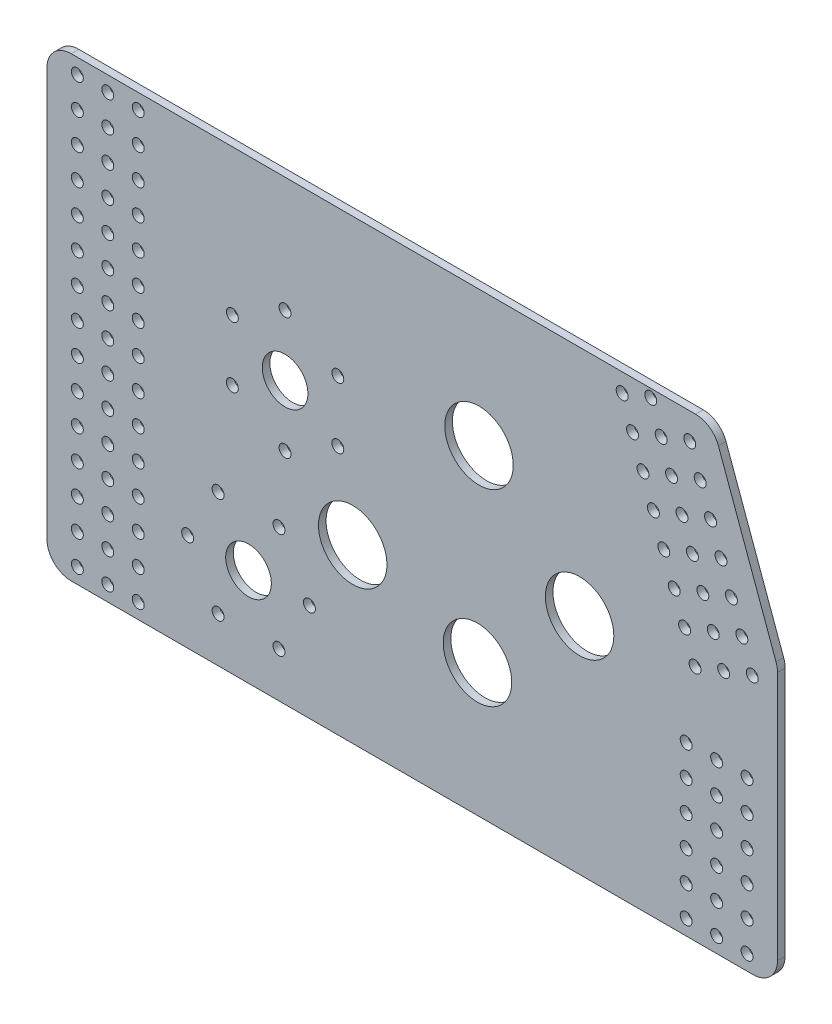
from build123d import *

# Parameters (mm, degrees)
SKETCH1_R           = 2.4892
SKETCH1_R_2         = 14.2875
SKETCH1_R_3         = 9.525
BOSS_EXTRUDE1_DEPTH = 3.175
BOSS_EXTRUDE2_START = -3.175
SKETCH2_R           = 2.4892
BOSS_EXTRUDE2_DEPTH = 3.175
FILLET1_R           = 10.16
CUT_EXTRUDE1_START  = -3.175
SKETCH3_R           = 9.525
SKETCH3_R_2         = 2.4892
CUT_EXTRUDE1_DEPTH  = 3.175
BOSS_EXTRUDE3_START = -3.175
SKETCH4_R           = 2.4892
BOSS_EXTRUDE3_DEPTH = 3.175
BOSS_EXTRUDE4_START = -3.175
SKETCH6_R           = 14.2875
SKETCH6_R_2         = 2.4892
SKETCH6_R_3         = 9.525
BOSS_EXTRUDE4_DEPTH = 3.175
SKETCH5_R           = 14.2875
CUT_EXTRUDE2_DEPTH  = 244.979693059
SKETCH7_R           = 2.4892
SKETCH7_R_2         = 9.525
CUT_EXTRUDE3_DEPTH  = 244.979693059


with BuildPart() as part:
    # Sketch1 → Boss-Extrude1 (new body)
    with BuildSketch(Plane.XY):
        Polygon((-152.4, 0), (152.4, 0), (152.4, 116.084254136), (125.314883545, 190.5), (-152.4, 190.5), align=None)
        with Locations((-139.7, 184.15)):
            Circle(SKETCH1_R, mode=Mode.SUBTRACT)
        with Locations((-127, 184.15)):
            Circle(SKETCH1_R, mode=Mode.SUBTRACT)
        with Locations((-114.3, 184.15)):
            Circle(SKETCH1_R, mode=Mode.SUBTRACT)
        with Locations((-127, 171.45)):
            Circle(SKETCH1_R, mode=Mode.SUBTRACT)
        with Locations((-114.3, 171.45)):
            Circle(SKETCH1_R, mode=Mode.SUBTRACT)
        with Locations((-127, 158.75)):
            Circle(SKETCH1_R, mode=Mode.SUBTRACT)
        with Locations((-114.3, 158.75)):
            Circle(SKETCH1_R, mode=Mode.SUBTRACT)
        with Locations((-127, 146.05)):
            Circle(SKETCH1_R, mode=Mode.SUBTRACT)
        with Locations((-114.3, 146.05)):
            Circle(SKETCH1_R, mode=Mode.SUBTRACT)
        with Locations((-127, 133.35)):
            Circle(SKETCH1_R, mode=Mode.SUBTRACT)
        with Locations((-114.3, 133.35)):
            Circle(SKETCH1_R, mode=Mode.SUBTRACT)
        with Locations((-127, 120.65)):
            Circle(SKETCH1_R, mode=Mode.SUBTRACT)
        with Locations((-114.3, 120.65)):
            Circle(SKETCH1_R, mode=Mode.SUBTRACT)
        with Locations((-127, 107.95)):
            Circle(SKETCH1_R, mode=Mode.SUBTRACT)
        with Locations((-114.3, 107.95)):
            Circle(SKETCH1_R, mode=Mode.SUBTRACT)
        with Locations((-127, 95.25)):
            Circle(SKETCH1_R, mode=Mode.SUBTRACT)
        with Locations((-114.3, 95.25)):
            Circle(SKETCH1_R, mode=Mode.SUBTRACT)
        with Locations((-127, 82.55)):
            Circle(SKETCH1_R, mode=Mode.SUBTRACT)
        with Locations((-114.3, 82.55)):
            Circle(SKETCH1_R, mode=Mode.SUBTRACT)
        with Locations((-127, 69.85)):
            Circle(SKETCH1_R, mode=Mode.SUBTRACT)
        with Locations((-114.3, 69.85)):
            Circle(SKETCH1_R, mode=Mode.SUBTRACT)
        with Locations((-127, 57.15)):
            Circle(SKETCH1_R, mode=Mode.SUBTRACT)
        with Locations((-114.3, 57.15)):
            Circle(SKETCH1_R, mode=Mode.SUBTRACT)
        with Locations((-127, 44.45)):
            Circle(SKETCH1_R, mode=Mode.SUBTRACT)
        with Locations((-114.3, 44.45)):
            Circle(SKETCH1_R, mode=Mode.SUBTRACT)
        with Locations((-127, 31.75)):
            Circle(SKETCH1_R, mode=Mode.SUBTRACT)
        with Locations((-114.3, 31.75)):
            Circle(SKETCH1_R, mode=Mode.SUBTRACT)
        with Locations((-127, 19.05)):
            Circle(SKETCH1_R, mode=Mode.SUBTRACT)
        with Locations((-114.3, 19.05)):
            Circle(SKETCH1_R, mode=Mode.SUBTRACT)
        with Locations((-127, 6.35)):
            Circle(SKETCH1_R, mode=Mode.SUBTRACT)
        with Locations((-114.3, 6.35)):
            Circle(SKETCH1_R, mode=Mode.SUBTRACT)
        with Locations((-139.7, 171.45)):
            Circle(SKETCH1_R, mode=Mode.SUBTRACT)
        with Locations((-139.7, 158.75)):
            Circle(SKETCH1_R, mode=Mode.SUBTRACT)
        with Locations((-139.7, 146.05)):
            Circle(SKETCH1_R, mode=Mode.SUBTRACT)
        with Locations((-139.7, 133.35)):
            Circle(SKETCH1_R, mode=Mode.SUBTRACT)
        with Locations((-139.7, 120.65)):
            Circle(SKETCH1_R, mode=Mode.SUBTRACT)
        with Locations((-139.7, 107.95)):
            Circle(SKETCH1_R, mode=Mode.SUBTRACT)
        with Locations((-139.7, 95.25)):
            Circle(SKETCH1_R, mode=Mode.SUBTRACT)
        with Locations((-139.7, 82.55)):
            Circle(SKETCH1_R, mode=Mode.SUBTRACT)
        with Locations((-139.7, 69.85)):
            Circle(SKETCH1_R, mode=Mode.SUBTRACT)
        with Locations((-139.7, 57.15)):
            Circle(SKETCH1_R, mode=Mode.SUBTRACT)
        with Locations((-139.7, 44.45)):
            Circle(SKETCH1_R, mode=Mode.SUBTRACT)
        with Locations((-139.7, 31.75)):
            Circle(SKETCH1_R, mode=Mode.SUBTRACT)
        with Locations((-139.7, 19.05)):
            Circle(SKETCH1_R, mode=Mode.SUBTRACT)
        with Locations((-139.7, 6.35)):
            Circle(SKETCH1_R, mode=Mode.SUBTRACT)
        with Locations((87.590706137, 182.74937795)):
            Circle(SKETCH1_R, mode=Mode.SUBTRACT)
        with Locations((99.524802421, 187.09303377)):
            Circle(SKETCH1_R, mode=Mode.SUBTRACT)
        with Locations((115.802554525, 179.502593307)):
            Circle(SKETCH1_R, mode=Mode.SUBTRACT)
        with Locations((91.934361957, 170.815281666)):
            Circle(SKETCH1_R, mode=Mode.SUBTRACT)
        with Locations((103.868458241, 175.158937486)):
            Circle(SKETCH1_R, mode=Mode.SUBTRACT)
        with Locations((120.146210345, 167.568497023)):
            Circle(SKETCH1_R, mode=Mode.SUBTRACT)
        with Locations((96.278017777, 158.881185382)):
            Circle(SKETCH1_R, mode=Mode.SUBTRACT)
        with Locations((108.212114061, 163.224841202)):
            Circle(SKETCH1_R, mode=Mode.SUBTRACT)
        with Locations((124.489866165, 155.634400739)):
            Circle(SKETCH1_R, mode=Mode.SUBTRACT)
        with Locations((100.621673597, 146.947089098)):
            Circle(SKETCH1_R, mode=Mode.SUBTRACT)
        with Locations((112.555769881, 151.290744918)):
            Circle(SKETCH1_R, mode=Mode.SUBTRACT)
        with Locations((128.833521986, 143.700304455)):
            Circle(SKETCH1_R, mode=Mode.SUBTRACT)
        with Locations((104.965329418, 135.012992814)):
            Circle(SKETCH1_R, mode=Mode.SUBTRACT)
        with Locations((116.899425702, 139.356648634)):
            Circle(SKETCH1_R, mode=Mode.SUBTRACT)
        with Locations((133.177177806, 131.766208171)):
            Circle(SKETCH1_R, mode=Mode.SUBTRACT)
        with Locations((109.308985238, 123.07889653)):
            Circle(SKETCH1_R, mode=Mode.SUBTRACT)
        with Locations((121.243081522, 127.42255235)):
            Circle(SKETCH1_R, mode=Mode.SUBTRACT)
        with Locations((137.520833626, 119.832111887)):
            Circle(SKETCH1_R, mode=Mode.SUBTRACT)
        with Locations((113.652641058, 111.144800246)):
            Circle(SKETCH1_R, mode=Mode.SUBTRACT)
        with Locations((125.586737342, 115.488456066)):
            Circle(SKETCH1_R, mode=Mode.SUBTRACT)
        with Locations((141.864489446, 107.898015603)):
            Circle(SKETCH1_R, mode=Mode.SUBTRACT)
        with Locations((117.996296878, 99.210703962)):
            Circle(SKETCH1_R, mode=Mode.SUBTRACT)
        with Locations((129.930393162, 103.554359782)):
            Circle(SKETCH1_R, mode=Mode.SUBTRACT)
        with Locations((146.208145266, 95.963919319)):
            Circle(SKETCH1_R, mode=Mode.SUBTRACT)
        with Locations((114.3, 69.85)):
            Circle(SKETCH1_R, mode=Mode.SUBTRACT)
        with Locations((127, 69.85)):
            Circle(SKETCH1_R, mode=Mode.SUBTRACT)
        with Locations((139.7, 69.85)):
            Circle(SKETCH1_R, mode=Mode.SUBTRACT)
        with Locations((114.3, 57.15)):
            Circle(SKETCH1_R, mode=Mode.SUBTRACT)
        with Locations((127, 57.15)):
            Circle(SKETCH1_R, mode=Mode.SUBTRACT)
        with Locations((139.7, 57.15)):
            Circle(SKETCH1_R, mode=Mode.SUBTRACT)
        with Locations((114.3, 44.45)):
            Circle(SKETCH1_R, mode=Mode.SUBTRACT)
        with Locations((127, 44.45)):
            Circle(SKETCH1_R, mode=Mode.SUBTRACT)
        with Locations((139.7, 44.45)):
            Circle(SKETCH1_R, mode=Mode.SUBTRACT)
        with Locations((114.3, 31.75)):
            Circle(SKETCH1_R, mode=Mode.SUBTRACT)
        with Locations((127, 31.75)):
            Circle(SKETCH1_R, mode=Mode.SUBTRACT)
        with Locations((139.7, 31.75)):
            Circle(SKETCH1_R, mode=Mode.SUBTRACT)
        with Locations((114.3, 19.05)):
            Circle(SKETCH1_R, mode=Mode.SUBTRACT)
        with Locations((127, 19.05)):
            Circle(SKETCH1_R, mode=Mode.SUBTRACT)
        with Locations((139.7, 19.05)):
            Circle(SKETCH1_R, mode=Mode.SUBTRACT)
        with Locations((114.3, 6.35)):
            Circle(SKETCH1_R, mode=Mode.SUBTRACT)
        with Locations((127, 6.35)):
            Circle(SKETCH1_R, mode=Mode.SUBTRACT)
        with Locations((139.7, 6.35)):
            Circle(SKETCH1_R, mode=Mode.SUBTRACT)
        with Locations((11.850775283, 132.016841695)):
            Circle(SKETCH1_R_2, mode=Mode.SUBTRACT)
        with Locations((-24.819733341, 71.744857423)):
            Circle(SKETCH1_R_2, mode=Mode.SUBTRACT)
        with Locations((57.635078008, 95.712451111)):
            Circle(SKETCH1_R_2, mode=Mode.SUBTRACT)
        with Locations((23.754601626, 49.678686248)):
            Circle(SKETCH1_R_2, mode=Mode.SUBTRACT)
        with Locations((-65.270180641, 36.953448556)):
            Circle(SKETCH1_R_3, mode=Mode.SUBTRACT)
        with Locations((-65.270180641, 106.549448556)):
            Circle(SKETCH1_R_3, mode=Mode.SUBTRACT)
        with Locations((-65.270180641, 131.949448556)):
            Circle(SKETCH1_R, mode=Mode.SUBTRACT)
        with Locations((-65.270180641, 11.553448556)):
            Circle(SKETCH1_R, mode=Mode.SUBTRACT)
        with Locations((-43.273135384, 119.249448556)):
            Circle(SKETCH1_R, mode=Mode.SUBTRACT)
        with Locations((-43.273135384, 93.849448556)):
            Circle(SKETCH1_R, mode=Mode.SUBTRACT)
        with Locations((-65.270180641, 81.149448556)):
            Circle(SKETCH1_R, mode=Mode.SUBTRACT)
        with Locations((-87.267225897, 93.849448556)):
            Circle(SKETCH1_R, mode=Mode.SUBTRACT)
        with Locations((-87.267225897, 119.249448556)):
            Circle(SKETCH1_R, mode=Mode.SUBTRACT)
        with Locations((-87.267225897, 24.253448556)):
            Circle(SKETCH1_R, mode=Mode.SUBTRACT)
        with Locations((-87.267225897, 49.653448556)):
            Circle(SKETCH1_R, mode=Mode.SUBTRACT)
        with Locations((-65.270180641, 62.353448556)):
            Circle(SKETCH1_R, mode=Mode.SUBTRACT)
        with Locations((-43.273135384, 49.653448556)):
            Circle(SKETCH1_R, mode=Mode.SUBTRACT)
        with Locations((-43.273135384, 24.253448556)):
            Circle(SKETCH1_R, mode=Mode.SUBTRACT)
    extrude(amount=BOSS_EXTRUDE1_DEPTH)

    # Sketch2 → Boss-Extrude2 (add)
    with BuildSketch(Plane.XY.offset(3.175).offset(BOSS_EXTRUDE2_START)):
        with Locations((146.208145266, 95.963919319)):
            Circle(SKETCH2_R)
    extrude(amount=BOSS_EXTRUDE2_DEPTH)

    # Fillet1
    fillet1_edges = [part.edges().sort_by_distance(p)[0] for p in [
        (-152.4, 190.5, 1.5875),
        (125.314883545, 190.5, 1.5875),
        (152.4, 116.084254136, 1.5875),
        (152.4, 0, 1.5875),
        (-152.4, 0, 1.5875),
    ]]
    fillet(fillet1_edges, radius=FILLET1_R)

    # Sketch3 → Cut-Extrude1 (cut)
    with BuildSketch(Plane.XY.offset(3.175).offset(CUT_EXTRUDE1_START)):
        with Locations((-65.270180641, 106.549448556)):
            Circle(SKETCH3_R)
        with Locations((-39.870180641, 106.549448556)):
            Circle(SKETCH3_R_2)
        with Locations((-52.570180641, 84.5524033)):
            Circle(SKETCH3_R_2)
        with Locations((-77.970180641, 84.5524033)):
            Circle(SKETCH3_R_2)
        with Locations((-90.670180641, 106.549448556)):
            Circle(SKETCH3_R_2)
        with Locations((-77.970180641, 128.546493812)):
            Circle(SKETCH3_R_2)
        with Locations((-52.570180641, 128.546493812)):
            Circle(SKETCH3_R_2)
        with Locations((-65.270180641, 36.953448556)):
            Circle(SKETCH3_R)
        with Locations((-39.870180641, 36.953448556)):
            Circle(SKETCH3_R_2)
        with Locations((-52.570180641, 14.9564033)):
            Circle(SKETCH3_R_2)
        with Locations((-77.970180641, 14.9564033)):
            Circle(SKETCH3_R_2)
        with Locations((-90.670180641, 36.953448556)):
            Circle(SKETCH3_R_2)
        with Locations((-77.970180641, 58.950493812)):
            Circle(SKETCH3_R_2)
        with Locations((-52.570180641, 58.950493812)):
            Circle(SKETCH3_R_2)
    extrude(amount=CUT_EXTRUDE1_DEPTH, mode=Mode.SUBTRACT)

    # Sketch4 → Boss-Extrude3 (add)
    with BuildSketch(Plane.XY.offset(3.175).offset(BOSS_EXTRUDE3_START)):
        with Locations((-65.270180641, 131.949448556)):
            Circle(SKETCH4_R)
        with Locations((-43.273135384, 119.249448556)):
            Circle(SKETCH4_R)
        with Locations((-43.273135384, 93.849448556)):
            Circle(SKETCH4_R)
        with Locations((-65.270180641, 81.149448556)):
            Circle(SKETCH4_R)
        with Locations((-87.267225897, 93.849448556)):
            Circle(SKETCH4_R)
        with Locations((-87.267225897, 119.249448556)):
            Circle(SKETCH4_R)
        with Locations((-65.270180641, 62.353448556)):
            Circle(SKETCH4_R)
        with Locations((-43.273135384, 49.653448556)):
            Circle(SKETCH4_R)
        with Locations((-43.273135384, 24.253448556)):
            Circle(SKETCH4_R)
        with Locations((-65.270180641, 11.553448556)):
            Circle(SKETCH4_R)
        with Locations((-87.267225897, 24.253448556)):
            Circle(SKETCH4_R)
        with Locations((-87.267225897, 49.653448556)):
            Circle(SKETCH4_R)
    extrude(amount=BOSS_EXTRUDE3_DEPTH)

    # Sketch6 → Boss-Extrude4 (add)
    with BuildSketch(Plane.XY.offset(3.175).offset(BOSS_EXTRUDE4_START)):
        with Locations((23.754601626, 49.678686248)):
            Circle(SKETCH6_R)
        with Locations((57.635078008, 95.712451111)):
            Circle(SKETCH6_R)
        with Locations((11.850775283, 132.016841695)):
            Circle(SKETCH6_R)
        with Locations((-39.870180641, 36.953448556)):
            Circle(SKETCH6_R_2)
        with Locations((-52.570180641, 14.9564033)):
            Circle(SKETCH6_R_2)
        with Locations((-77.970180641, 14.9564033)):
            Circle(SKETCH6_R_2)
        with Locations((-65.270180641, 36.953448556)):
            Circle(SKETCH6_R_3)
        with Locations((-90.670180641, 36.953448556)):
            Circle(SKETCH6_R_2)
        with Locations((-52.570180641, 58.950493812)):
            Circle(SKETCH6_R_2)
        with Locations((-77.970180641, 58.950493812)):
            Circle(SKETCH6_R_2)
        with Locations((-52.570180641, 84.5524033)):
            Circle(SKETCH6_R_2)
        with Locations((-77.970180641, 84.5524033)):
            Circle(SKETCH6_R_2)
        with Locations((-90.670180641, 106.549448556)):
            Circle(SKETCH6_R_2)
        with Locations((-65.270180641, 106.549448556)):
            Circle(SKETCH6_R_3)
        with Locations((-39.870180641, 106.549448556)):
            Circle(SKETCH6_R_2)
        with Locations((-52.570180641, 128.546493812)):
            Circle(SKETCH6_R_2)
        with Locations((-77.970180641, 128.546493812)):
            Circle(SKETCH6_R_2)
    extrude(amount=BOSS_EXTRUDE4_DEPTH)

    # Sketch5 → Cut-Extrude2 (cut, through all)
    with BuildSketch(Plane.XY.offset(3.175)):
        with Locations((27.23477655, 55.234857423)):
            Circle(SKETCH5_R)
        with Locations((69.831871522, 93.334857423)):
            Circle(SKETCH5_R)
        with Locations((27.864183951, 133.974857423)):
            Circle(SKETCH5_R)
    extrude(amount=-CUT_EXTRUDE2_DEPTH, mode=Mode.SUBTRACT)

    # Sketch7 → Cut-Extrude3 (cut, through all)
    with BuildSketch(Plane.XY):
        with Locations((-93.674305174, 40.81177179)):
            Circle(SKETCH7_R)
        with Locations((-80.974305174, 62.808817046)):
            Circle(SKETCH7_R)
        with Locations((-42.874305174, 40.81177179)):
            Circle(SKETCH7_R)
        with Locations((-55.574305174, 62.808817046)):
            Circle(SKETCH7_R)
        with Locations((-80.974305174, 18.814726534)):
            Circle(SKETCH7_R)
        with Locations((-55.574305174, 18.814726534)):
            Circle(SKETCH7_R)
        with Locations((-68.274305174, 40.81177179)):
            Circle(SKETCH7_R_2)
        with Locations((-75.03135043, 129.71177179)):
            Circle(SKETCH7_R)
        with Locations((-53.034305174, 117.01177179)):
            Circle(SKETCH7_R_2)
        with Locations((-53.034305174, 142.41177179)):
            Circle(SKETCH7_R)
        with Locations((-53.034305174, 91.61177179)):
            Circle(SKETCH7_R)
        with Locations((-31.037259918, 104.31177179)):
            Circle(SKETCH7_R)
        with Locations((-31.037259918, 129.71177179)):
            Circle(SKETCH7_R)
        with Locations((-75.03135043, 104.31177179)):
            Circle(SKETCH7_R)
    extrude(amount=CUT_EXTRUDE3_DEPTH, mode=Mode.SUBTRACT)


solid = part.part
